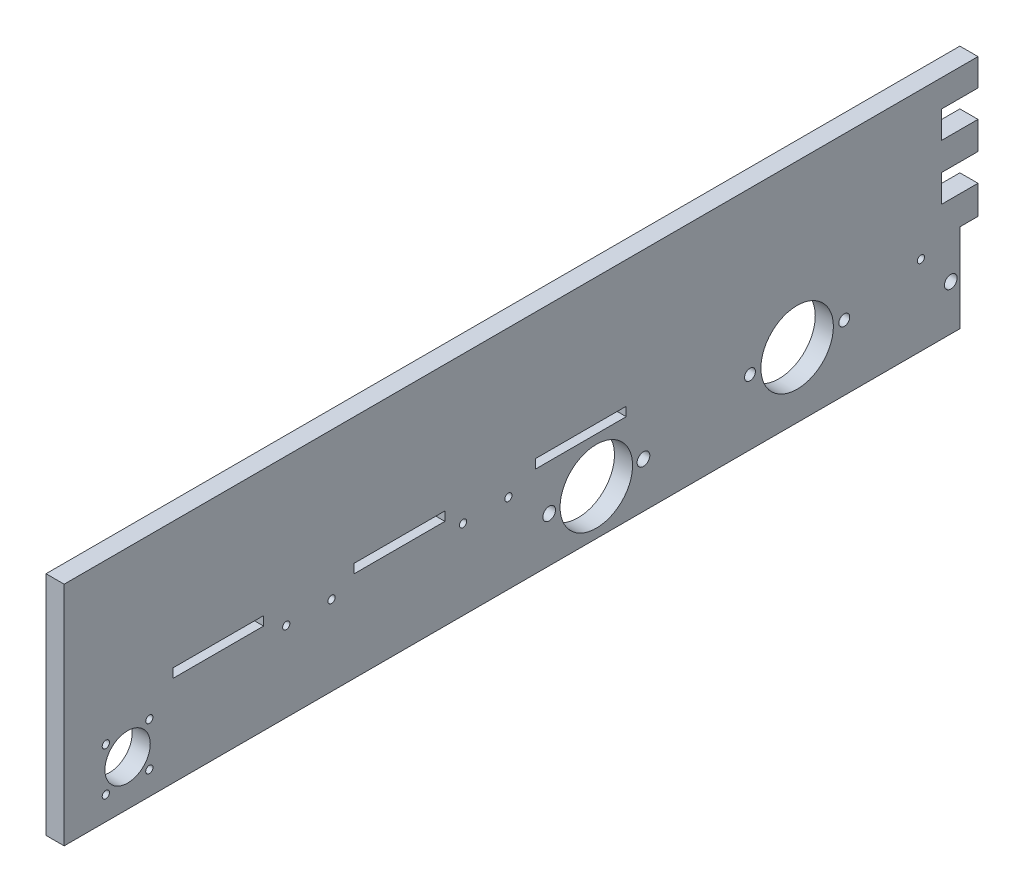
from build123d import *

# Parameters (mm, degrees)
EXTRUDE_2_DEPTH      = 10
SKETCH_3_R           = 3.5
SKETCH_3_R_2         = 20
SKETCH_3_R_3         = 2
SKETCH_3_R_4         = 12.5
CUT_EXTRUDE_1_DEPTH  = 660.636515889
SKETCH_6_W           = 10
SKETCH_6_H           = 50
CUT_EXTRUDE_14_DEPTH = 5
SKETCH_7_W           = 45
SKETCH_7_H           = 5
SKETCH_7_W_2         = 50
CUT_EXTRUDE_17_DEPTH = 660.636515889
SKETCH_4_R           = 2
CUT_EXTRUDE_18_DEPTH = 10
SKETCH_8_W           = 10
SKETCH_8_H           = 55
EXTRUDE_3_DEPTH      = 10
SKETCH_9_R           = 3.5
SKETCH_9_R_2         = 20
CUT_EXTRUDE_19_DEPTH = 660.636515889
EXTRUDE_4_DEPTH      = 10
SKETCH_14_R          = 20
SKETCH_14_R_2        = 3
CUT_EXTRUDE_20_DEPTH = 660.636515889
SKETCH_15_R          = 2
CUT_EXTRUDE_22_DEPTH = 660.636515889
CUT_EXTRUDE_25_DEPTH = 660.636515889


with BuildPart() as part:
    # 스케치1 → 보스-돌출2 (new body)
    with BuildSketch(Plane(origin=(0, 0, 0), x_dir=(0, 0, -1), z_dir=(1, 0, 0))):
        with BuildLine():
            Line((-350, -25), (353.480885827, -25))
            ThreePointArc((353.480885827, -25), (359.679041929, -24.015332259), (365.266885594, -21.158286093))
            Line((365.266885594, -21.158286093), (609.458437468, 155.703306991))
            ThreePointArc((609.458437468, 155.703306991), (620.947494037, 196.239910069), (580.410890959, 207.728966637))
            Line((580.410890959, 207.728966637), (150, 30))
            Line((150, 30), (-350, 30))
            Line((-350, 30), (-350, -25))
        make_face()
    extrude(amount=EXTRUDE_2_DEPTH)

    # 스케치3 → 컷-돌출1 (cut, through all)
    with BuildSketch(Plane(origin=(10, 0, 0), x_dir=(0, 0, -1), z_dir=(1, 0, 0))):
        with Locations((613.415951219, 194.53901549)):
            Circle(SKETCH_3_R)
        with Locations((570.305997446, 165.46098451)):
            Circle(SKETCH_3_R)
        with Locations((591.860974332, 180)):
            Circle(SKETCH_3_R_2)
        with Locations((337, -12)):
            Circle(SKETCH_3_R_3)
        with Locations((313, 12)):
            Circle(SKETCH_3_R_3)
        with Locations((313, -12)):
            Circle(SKETCH_3_R_3)
        with Locations((337, 12)):
            Circle(SKETCH_3_R_3)
        with Locations((325, 0)):
            Circle(SKETCH_3_R_4)
        with Locations((-313, -12)):
            Circle(SKETCH_3_R_3)
        with Locations((-313, 12)):
            Circle(SKETCH_3_R_3)
        with Locations((-325, 0)):
            Circle(SKETCH_3_R_4)
        with Locations((-337, -12)):
            Circle(SKETCH_3_R_3)
        with Locations((-337, 12)):
            Circle(SKETCH_3_R_3)
    extrude(amount=-CUT_EXTRUDE_1_DEPTH, mode=Mode.SUBTRACT)

    # 스케치6 → 컷-돌출14 (cut)
    with BuildSketch(Plane(origin=(0, 30, 0), x_dir=(1, 0, 0), z_dir=(0, 1, 0))):
        with Locations((5, -75)):
            Rectangle(SKETCH_6_W, SKETCH_6_H)
        with Locations((5, -275)):
            Rectangle(SKETCH_6_W, SKETCH_6_H)
        with Locations((5, 75)):
            Rectangle(SKETCH_6_W, SKETCH_6_H)
        with Locations((5, -175)):
            Rectangle(SKETCH_6_W, SKETCH_6_H)
    extrude(amount=-CUT_EXTRUDE_14_DEPTH, mode=Mode.SUBTRACT)

    # 스케치7 → 컷-돌출17 (cut, through all)
    with BuildSketch(Plane(origin=(10, 0, 0), x_dir=(0, 0, -1), z_dir=(1, 0, 0))):
        with Locations((177.5, 27.5)):
            Rectangle(SKETCH_7_W, SKETCH_7_H)
        with Locations((275, 27.5)):
            Rectangle(SKETCH_7_W_2, SKETCH_7_H)
    extrude(amount=-CUT_EXTRUDE_17_DEPTH, mode=Mode.SUBTRACT)

    # 스케치4 → 컷-돌출18 (cut)
    with BuildSketch(Plane(origin=(10, 0, 0), x_dir=(0, 0, -1), z_dir=(1, 0, 0))):
        with Locations((-237.5, 19)):
            Circle(SKETCH_4_R)
        with Locations(Location((-212.5, 19, 0), (0, 0, 180))):
            Circle(SKETCH_4_R)
        with Locations((-139.996213119, 19)):
            Circle(SKETCH_4_R)
        with Locations(Location((-114.996213119, 19, 0), (0, 0, 180))):
            Circle(SKETCH_4_R)
        with Locations((112.5, 19)):
            Circle(SKETCH_4_R)
        with Locations((212.5, 19)):
            Circle(SKETCH_4_R)
        with Locations(Location((237.5, 19, 0), (0, 0, 180))):
            Circle(SKETCH_4_R)
    extrude(amount=-CUT_EXTRUDE_18_DEPTH, mode=Mode.SUBTRACT)

    # 스케치8 → 보스-돌출3 (add)
    with BuildSketch(Plane.XY.offset(350)):
        with Locations((5, 2.5)):
            Rectangle(SKETCH_8_W, SKETCH_8_H)
    extrude(amount=EXTRUDE_3_DEPTH)

    # 스케치9 → 컷-돌출19 (cut, through all)
    with BuildSketch(Plane(origin=(10, 0, 0), x_dir=(0, 0, -1), z_dir=(1, 0, 0))):
        with Locations((-92.5, 0)):
            Circle(SKETCH_9_R)
        with Locations(Location((-40.5, 0, 0), (0, 0, 180))):
            Circle(SKETCH_9_R)
        with Locations(Location((-66.5, 0, 0), (0, 0, 180))):
            Circle(SKETCH_9_R_2)
        with Locations((155, 0)):
            Circle(SKETCH_9_R_2)
        with Locations((181, 0)):
            Circle(SKETCH_9_R)
        with Locations(Location((129, 0, 0), (0, 0, 180))):
            Circle(SKETCH_9_R)
    extrude(amount=-CUT_EXTRUDE_19_DEPTH, mode=Mode.SUBTRACT)

    # 스케치10 → 보스-돌출4 (add)
    with BuildSketch(Plane(origin=(0, 0, 0), x_dir=(0, 0, -1), z_dir=(1, 0, 0))):
        Polygon((100, 30), (100, 25), (50, 25), (50, 30), (-50, 30), (-360, 30), (-360, 100), (-50, 100), (319.520832407, 100), (150, 30), align=None)
    extrude(amount=EXTRUDE_4_DEPTH)

    # 스케치14 → 컷-돌출20 (cut, through all)
    with BuildSketch(Plane(origin=(10, 0, 0), x_dir=(0, 0, -1), z_dir=(1, 0, 0))):
        with Locations((44.25, 11)):
            Circle(SKETCH_14_R)
        with Locations((70.25, 11)):
            Circle(SKETCH_14_R_2)
        with Locations(Location((18.25, 11, 0), (0, 0, 180))):
            Circle(SKETCH_14_R_2)
    extrude(amount=-CUT_EXTRUDE_20_DEPTH, mode=Mode.SUBTRACT)

    # 스케치15 → 컷-돌출22 (cut, through all)
    with BuildSketch(Plane(origin=(10, 0, 0), x_dir=(0, 0, -1), z_dir=(1, 0, 0))):
        with Locations((331.433412373, 50.824001827)):
            Circle(SKETCH_15_R)
        with Locations((316.195018887, 87.807665301)):
            Circle(SKETCH_15_R)
        with Locations(Location((451.630318664, 100.348780655, 0), (0, 0, 180))):
            Circle(SKETCH_15_R)
        with Locations(Location((436.391925178, 137.332444129, 0), (0, 0, 180))):
            Circle(SKETCH_15_R)
    extrude(amount=-CUT_EXTRUDE_22_DEPTH, mode=Mode.SUBTRACT)

    # 스케치17 → 컷-돌출25 (cut, through all)
    with BuildSketch(Plane(origin=(10, 0, 0), x_dir=(0, 0, -1), z_dir=(1, 0, 0))):
        Polygon((134, 100), (144, 100), (144, 85), (124, 85), (124, 70.009449614), (144, 70.009449614), (144, 54.646019177), (124, 54.646019177), (124, 39.485590498), (144, 39.485590498), (144, 23.660735911), (134, 23.660735911), (134, -25.259204994), (695.028977211, -25.259204994), (695.028977211, 260.6847899), (134, 260.6847899), align=None)
    extrude(amount=-CUT_EXTRUDE_25_DEPTH, mode=Mode.SUBTRACT)


solid = part.part
